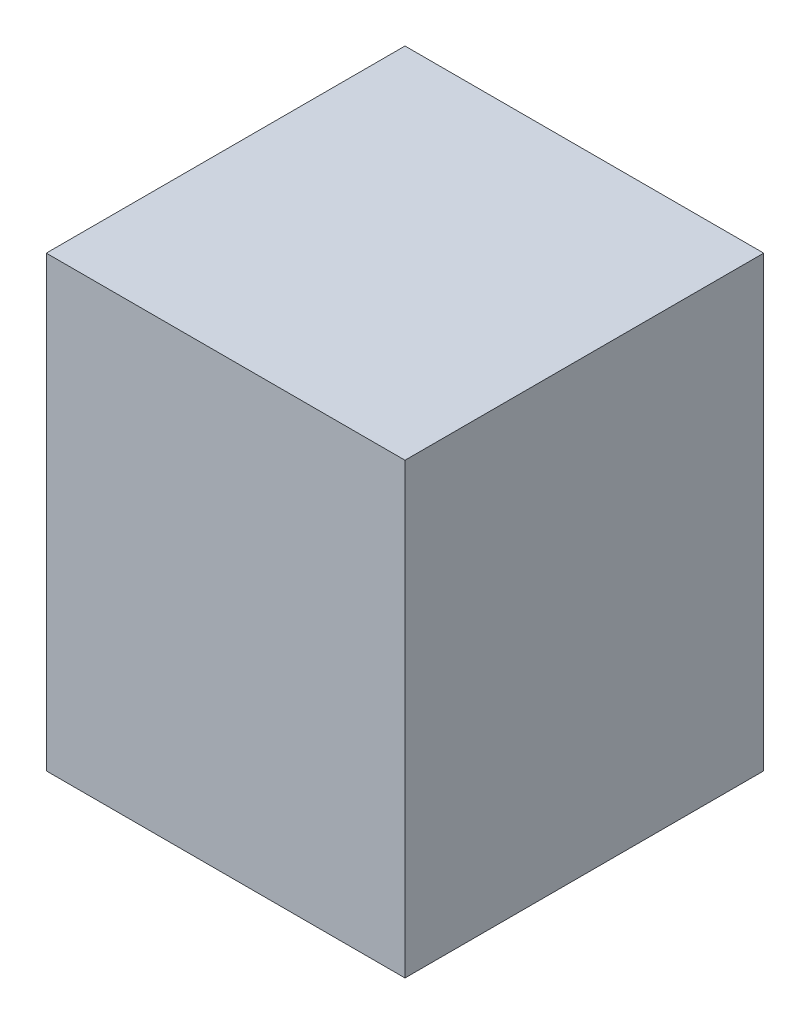
from build123d import *

# Parameters (mm, degrees)
SKETCH1_W     = 80
SKETCH1_H     = 80
PAYLOAD_DEPTH = 100


with BuildPart() as part:
    # Sketch1 → Payload (new body)
    with BuildSketch(Plane(origin=(0, 0, 0), x_dir=(1, 0, 0), z_dir=(0, 1, 0))):
        with Locations((40, 40)):
            Rectangle(SKETCH1_W, SKETCH1_H)
    extrude(amount=PAYLOAD_DEPTH)


solid = part.part
